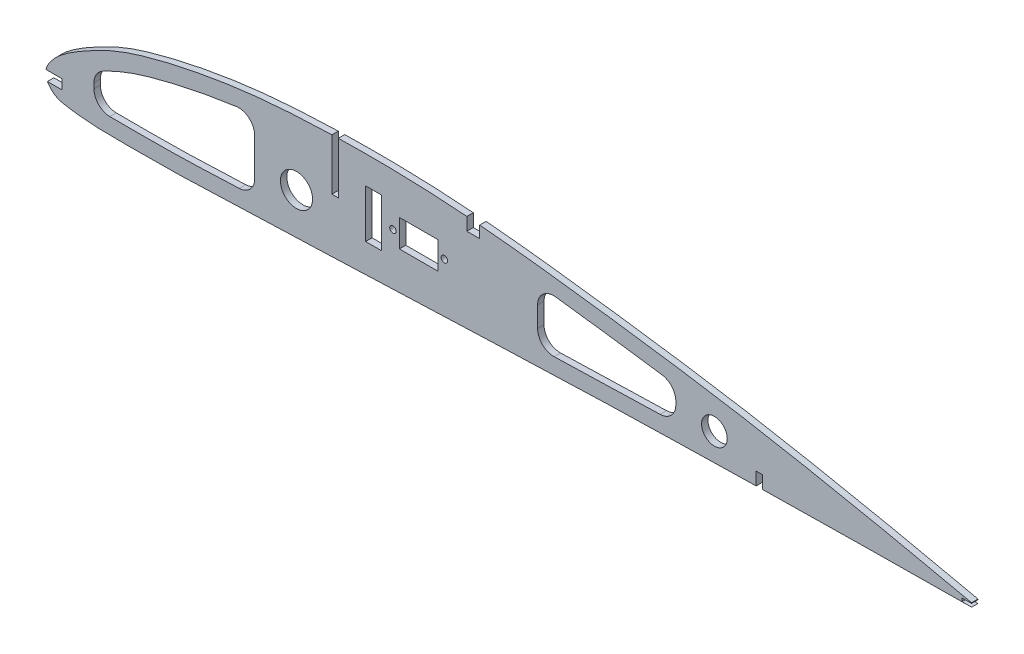
from build123d import *

# Parameters (mm, degrees)
SKETCH_1_R          = 5
SKETCH_1_R_2        = 4
EXTRUDE_1_DEPTH     = 2
SKETCH_3_W          = 5
SKETCH_3_H          = 15
SKETCH_3_W_2        = 12
SKETCH_3_H_2        = 8.5
SKETCH_3_R          = 1
SKETCH_3_W_3        = 4
SKETCH_3_H_3        = 4
CUT_EXTRUDE_2_DEPTH = 291.413778556


with BuildPart() as part:
    # 草图1 → 凸台-拉伸1 (new body)
    with BuildSketch(Plane.XY):
        with BuildLine():
            Line((90, 12.3715), (90, 28.372426217))
            add(Edge.make_bspline(
                [(90, 28.372426217), (89.259446982, 28.350928743), (82.363996343, 28.13322439), (72.403347361, 27.586524792), (60.185862052, 26.226268085), (51.080991088, 24.79810862), (42.033943524, 23.000087944), (34.581994337, 21.174922903), (28.697351661, 19.44563851), (24.361981086, 17.983441115), (20.174828998, 16.207949367), (16.078941989, 14.139912989), (12.040296713, 11.946766626), (8.14011433, 9.56039573), (5.153679337, 7.316395724), (3.100060439, 5.200618052), (1.813825976, 3.470730924), (1.237398467, 2.180506339), (1.085380705, 1.529058937), (1.078882286, 1.5)],
                knots=[0.345773533, 0.345773533, 0.345773533, 0.345773533, 0.349398211, 0.379527288, 0.394591827, 0.409656366, 0.424720905, 0.439785444, 0.447317713, 0.454849983, 0.462382252, 0.469914522, 0.477446791, 0.484979061, 0.49251133, 0.496277465, 0.5000436, 0.503809734, 0.503985678, 0.503985678, 0.503985678, 0.503985678], degree=3))
            Line((1.078882286, 1.5), (6, 1.5))
            Line((6, 1.5), (6, -1.5))
            Line((6, -1.5), (1.522379628, -1.5))
            add(Edge.make_bspline(
                [(1.522379628, -1.5), (1.617903461, -1.678770523), (2.068186491, -2.42442122), (3.143139608, -3.601090845), (4.854253, -4.619355756), (6.927567017, -5.105597911), (9.209034621, -5.454839075), (12.219971865, -5.84289763), (16.020132359, -6.14266222), (20.609524976, -6.2611368), (25.231457517, -6.286948592), (31.397380169, -6.280305851), (39.107274969, -6.240736398), (48.336813051, -6.022096429), (57.579935967, -5.612990736), (66.840654471, -5.242934226), (76.096556555, -4.921715721), (88.435998513, -4.515955408), (103.853120896, -3.973102953), (122.354625015, -3.248110744), (140.857835973, -2.495489966), (159.368527813, -1.804089638), (177.884173919, -1.222493213), (196.4033921, -0.774877257), (211.106034353, -0.46143934), (219.638958118, -0.28014938), (222, -0.231405833)],
                knots=[0.510182255, 0.510182255, 0.510182255, 0.510182255, 0.511342004, 0.515108139, 0.518874273, 0.522640408, 0.526406543, 0.530172677, 0.537704947, 0.545237216, 0.552769486, 0.560301755, 0.575366294, 0.590430833, 0.605495372, 0.620559911, 0.63562445, 0.650688989, 0.680818067, 0.710947144, 0.741076222, 0.7712053, 0.801334378, 0.831463456, 0.861592533, 0.873117312, 0.873117312, 0.873117312, 0.873117312], degree=3))
            Line((222, -0.231405833), (222, 3.768284765))
            Line((222, 3.768284765), (224, 3.768284765))
            Line((224, 3.768284765), (224, -0.190486213))
            add(Edge.make_bspline(
                [(224, -0.190486213), (227.14486696, -0.126773539), (236.463303784, 0.052517956), (251.961175933, 0.256656825), (270.471854229, 0.429163033), (282.824771355, 0.587434741), (289, 0.610062865)],
                knots=[0.8763714, 0.8763714, 0.8763714, 0.8763714, 0.891721611, 0.921850689, 0.951979767, 0.982108845, 0.982108845, 0.982108845, 0.982108845], degree=3))
            Line((289, 0.610062865), (286, 0.610062865))
            Line((286, 0.610062865), (286, 1.610062865))
            Line((286, 1.610062865), (289, 1.610062865))
            Line((289, 1.610062865), (289, 1.816246039))
            add(Edge.make_bspline(
                [(289, 1.816246039), (276.957314444, 4.502285023), (258.861554155, 8.397620333), (234.648247971, 13.152786595), (216.448478593, 16.478914183), (198.182873559, 19.371550405), (179.850571346, 21.924148488), (161.503162682, 24.358614825), (143.127892269, 26.473190985), (124.712239059, 28.043780086), (107.661076739, 28.627794226), (96.749283398, 28.541845307), (92, 28.425883181)],
                knots=[0.017978355, 0.017978355, 0.017978355, 0.017978355, 0.07823651, 0.108365588, 0.138494666, 0.168623744, 0.198752821, 0.228881899, 0.259010977, 0.289140055, 0.319269133, 0.342510787, 0.342510787, 0.342510787, 0.342510787], degree=3))
            Line((92, 28.425883181), (92, 12.3715))
            Line((92, 12.3715), (90, 12.3715))
        make_face()
        with Locations((79, 8)):
            Circle(SKETCH_1_R, mode=Mode.SUBTRACT)
        with Locations((209, 8)):
            Circle(SKETCH_1_R_2, mode=Mode.SUBTRACT)
    extrude(amount=EXTRUDE_1_DEPTH)

    # 草图3 → 切除-拉伸2 (cut, through all)
    with BuildSketch(Plane.XY):
        with Locations((103, 12.3715)):
            Rectangle(SKETCH_3_W, SKETCH_3_H)
        with Locations((117, 12.3715)):
            Rectangle(SKETCH_3_W_2, SKETCH_3_H_2)
        with Locations((109, 12.3715)):
            Circle(SKETCH_3_R)
        with Locations(Location((125, 12.3715, 0), (0, 0, 180))):
            Circle(SKETCH_3_R)
        with Locations((133.995432672, 25.382316812)):
            Rectangle(SKETCH_3_W_3, SKETCH_3_H_3)
        with BuildLine():
            add(Edge.make_bspline(
                [(192.714090476, 15.060767244), (191.944613201, 15.171800732), (191.174825659, 15.282099728), (186.308954619, 15.974755997), (182.203786583, 16.539615577), (173.988030512, 17.653320176), (169.883033971, 18.199812389), (163.72254432, 18.989569369), (161.665308348, 19.2482867), (159.608604404, 19.500505924)],
                knots=[0.488248297, 0.488248297, 0.488248297, 0.488248297, 0.5, 0.5, 0.5625, 0.5625, 0.625, 0.625, 0.656347088, 0.656347088, 0.656347088, 0.656347088], degree=3))
            ThreePointArc((159.608604404, 19.500505924), (155.686619703, 18.282214891), (154, 14.537684078))
            Line((154, 14.537684078), (154, 8.170617563))
            ThreePointArc((154, 8.170617563), (155.525809704, 4.574786396), (159.172000715, 3.173576864))
            add(Edge.make_bspline(
                [(159.172000715, 3.173576864), (161.473677828, 3.252801775), (163.775686209, 3.329549926), (170.732455506, 3.552774746), (175.388689917, 3.690754395), (184.07020031, 3.924521784), (188.094738333, 4.024115619), (192.117455336, 4.118639618)],
                knots=[0.71908585, 0.71908585, 0.71908585, 0.71908585, 0.75, 0.75, 0.8125, 0.8125, 0.866546799, 0.866546799, 0.866546799, 0.866546799], degree=3))
            ThreePointArc((192.117455336, 4.118639618), (195.576819584, 5.623499462), (197, 9.117259852))
            Line((197, 9.117259852), (197, 10.112022474))
            ThreePointArc((197, 10.112022474), (195.77958016, 13.385365385), (192.714090476, 15.060767244))
        make_face()
        with BuildLine():
            add(Edge.make_bspline(
                [(20.926650195, -1.249889668), (21.774172276, -1.262324122), (22.628944162, -1.270076322), (24.631357544, -1.281688823), (25.78455057, -1.283642157), (29.246278981, -1.283863887), (31.564498991, -1.277624199), (36.178821914, -1.249716978), (38.477208261, -1.225805817), (43.065916773, -1.143353772), (45.357830447, -1.085798853), (49.942071524, -0.935363079), (52.243600435, -0.841029597), (56.765262426, -0.649905427), (58.983967724, -0.555595534), (61.201389309, -0.466209999)],
                knots=[0.097664849, 0.097664849, 0.097664849, 0.097664849, 0.109375, 0.109375, 0.125, 0.125, 0.15625, 0.15625, 0.1875, 0.1875, 0.21875, 0.21875, 0.25, 0.25, 0.279748342, 0.279748342, 0.279748342, 0.279748342], degree=3))
            ThreePointArc((61.201389309, -0.466209999), (64.606032899, 1.066132334), (66, 4.529732589))
            Line((66, 4.529732589), (66, 16.175207171))
            ThreePointArc((66, 16.175207171), (64.287676463, 19.942325894), (60.32352661, 21.129234195))
            add(Edge.make_bspline(
                [(60.32352661, 21.129234195), (59.143282742, 20.968071656), (57.964431768, 20.796736398), (53.109249428, 20.046773379), (49.445857595, 19.384253181), (42.158673028, 17.868714577), (38.533379611, 17.019586343), (33.148990447, 15.546220745), (31.362942012, 15.022439399), (27.821005995, 13.880218625), (26.067238608, 13.253271835), (22.635818059, 11.812670552), (20.957942753, 11.004847704), (19.099592195, 10.049689097), (18.896441621, 9.944700093), (18.693547477, 9.839213217)],
                knots=[0.029920383, 0.029920383, 0.029920383, 0.029920383, 0.033494004, 0.033494004, 0.044658672, 0.044658672, 0.05582334, 0.05582334, 0.061405674, 0.061405674, 0.066988008, 0.066988008, 0.072570342, 0.072570342, 0.073256353, 0.073256353, 0.073256353, 0.073256353], degree=3))
            ThreePointArc((18.693547477, 9.839213217), (16.726110517, 7.997937304), (16, 5.402967421))
            Line((16, 5.402967421), (16, 3.749572283))
            ThreePointArc((16, 3.749572283), (17.43862744, 0.240067263), (20.926650195, -1.249889668))
        make_face()
    extrude(amount=CUT_EXTRUDE_2_DEPTH, mode=Mode.SUBTRACT)


solid = part.part
